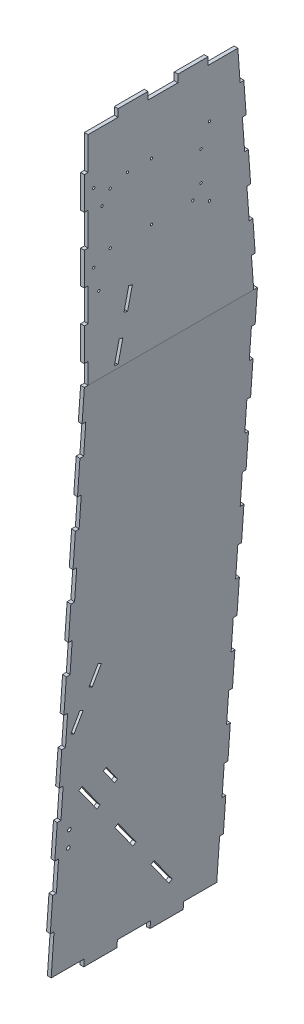
from build123d import *

# Parameters (mm, degrees)
BOSS_EXTRUDE1_DEPTH      = 469.9
SKETCH2_W                = 10.16
SKETCH2_H                = 83.651125112
SKETCH2_H_2              = 83.677721465
SKETCH2_H_3              = 83.704317819
SKETCH2_H_4              = 83.730914172
SKETCH2_H_5              = 83.757510526
SKETCH2_H_6              = 83.784106879
SKETCH2_H_7              = 83.810703233
SKETCH2_H_8              = 133.264269193
CUT_EXTRUDE1_DEPTH       = 10.16
SKETCH3_W                = 10.16
SKETCH3_H                = 55.879999965
SKETCH3_H_2              = 88.9
SKETCH3_H_3              = 109.22
CUT_EXTRUDE2_DEPTH       = 12.7
SKETCH4_W                = 81.316938584
SKETCH4_H                = 20.32
SKETCH4_W_2              = 81.316938585
CUT_EXTRUDE3_DEPTH       = 12.7
SKETCH5_W                = 89.916
SKETCH5_H                = 20.32
CUT_EXTRUDE4_DEPTH       = 12.7
SKETCH13_R               = 3.175
CUT_EXTRUDE8_DEPTH       = 2128.667464702
CUT_EXTRUDE9_DEPTH       = 2128.667464702
SKETCH20_R               = 4.7625
CUT_EXTRUDE10_DEPTH      = 2107.728843747
SKETCH24_R               = 3.175
CUT_EXTRUDE12_DEPTH      = 12.7
CUT_EXTRUDE13_DEPTH      = 2128.667464702
CUT_EXTRUDE13_DEPTH_BACK = 2128.667464702


with BuildPart() as part:
    # Sketch1 → Boss-Extrude1 (new body)
    with BuildSketch(Plane.XY):
        Polygon((-215.881789204, 2052.32), (-215.881789204, 1463.040000035), (-316.088635901, 20.32), (-317.499999939, 0), (-307.333509538, 0), (-205.715298803, 1463.040000035), (-205.715298803, 2072.64), (-215.881789204, 2072.64), align=None)
    extrude(amount=-BOSS_EXTRUDE1_DEPTH)

    # Sketch2 → Cut-Extrude1 (cut)
    with BuildSketch(Plane(origin=(-315.975651309, 21.946686571, 0), x_dir=(0, 0, 1), z_dir=(-0.9975965627192115, 0.06928995634877068, 0))):
        with Locations((-464.82, 1313.852971026)):
            Rectangle(SKETCH2_W, SKETCH2_H)
        with Locations((-464.82, 1136.066269203)):
            Rectangle(SKETCH2_W, SKETCH2_H_2)
        with Locations((-464.82, 958.27956738)):
            Rectangle(SKETCH2_W, SKETCH2_H_3)
        with Locations((-464.82, 780.492865556)):
            Rectangle(SKETCH2_W, SKETCH2_H_4)
        with Locations((-464.82, 602.706163733)):
            Rectangle(SKETCH2_W, SKETCH2_H_5)
        with Locations((-464.82, 424.91946191)):
            Rectangle(SKETCH2_W, SKETCH2_H_6)
        with Locations((-464.82, 247.132760087)):
            Rectangle(SKETCH2_W, SKETCH2_H_7)
        with Locations((-464.82, 44.63257346)):
            Rectangle(SKETCH2_W, SKETCH2_H_8)
        with Locations((-5.08, 44.63257346)):
            Rectangle(SKETCH2_W, SKETCH2_H_8)
        with Locations((-5.08, 247.132760087)):
            Rectangle(SKETCH2_W, SKETCH2_H_7)
        with Locations((-5.08, 424.91946191)):
            Rectangle(SKETCH2_W, SKETCH2_H_6)
        with Locations((-5.08, 602.706163733)):
            Rectangle(SKETCH2_W, SKETCH2_H_5)
        with Locations((-5.08, 780.492865556)):
            Rectangle(SKETCH2_W, SKETCH2_H_4)
        with Locations((-5.08, 958.27956738)):
            Rectangle(SKETCH2_W, SKETCH2_H_3)
        with Locations((-5.08, 1136.066269203)):
            Rectangle(SKETCH2_W, SKETCH2_H_2)
        with Locations((-5.08, 1313.852971026)):
            Rectangle(SKETCH2_W, SKETCH2_H)
    extrude(amount=-CUT_EXTRUDE1_DEPTH, mode=Mode.SUBTRACT)

    # Sketch3 → Cut-Extrude2 (cut)
    with BuildSketch(Plane.ZY.offset(215.881789204)):
        with Locations((-5.08, 1490.980000018)):
            Rectangle(SKETCH3_W, SKETCH3_H)
        with Locations((-5.08, 1652.27)):
            Rectangle(SKETCH3_W, SKETCH3_H_2)
        Polygon((-469.9, 1463.040000035), (-459.713026258, 1463.040000035), (-453.620872406, 1546.589538567), (-463.753970086, 1547.328410273), (-457.607940173, 1631.616820512), (-447.474842492, 1630.877948806), (-441.328812579, 1715.166359045), (-451.461910259, 1715.905230751), (-445.315880346, 1800.19364099), (-435.182782665, 1799.454769284), (-429.036752752, 1883.743179522), (-439.169850432, 1884.482051228), (-433.023820518, 1968.770461467), (-422.890722838, 1968.031589761), (-415.263026258, 2072.64), (-469.9, 2072.64), align=None)
        with Locations((-5.08, 1830.07)):
            Rectangle(SKETCH3_W, SKETCH3_H_2)
        with Locations((-5.08, 2018.03)):
            Rectangle(SKETCH3_W, SKETCH3_H_3)
    extrude(amount=-CUT_EXTRUDE2_DEPTH, mode=Mode.SUBTRACT)

    # Sketch4 → Cut-Extrude3 (cut)
    with BuildSketch(Plane.ZY.offset(215.881789204)):
        with Locations((-376.086223632, 2062.48)):
            Rectangle(SKETCH4_W, SKETCH4_H)
        with Locations((-213.452346463, 2062.48)):
            Rectangle(SKETCH4_W_2, SKETCH4_H)
        with Locations((-50.818469292, 2062.48)):
            Rectangle(SKETCH4_W_2, SKETCH4_H)
    extrude(amount=-CUT_EXTRUDE3_DEPTH, mode=Mode.SUBTRACT)

    # Sketch5 → Cut-Extrude4 (cut)
    with BuildSketch(Plane(origin=(-315.975651309, 21.946686571, 0), x_dir=(0, 0, 1), z_dir=(-0.9975965627192115, 0.06928995634877068, 0))):
        with Locations((-414.782, -11.839561137)):
            Rectangle(SKETCH5_W, SKETCH5_H)
        with Locations((-234.95, -11.839561137)):
            Rectangle(SKETCH5_W, SKETCH5_H)
        with Locations((-55.118, -11.839561137)):
            Rectangle(SKETCH5_W, SKETCH5_H)
    extrude(amount=-CUT_EXTRUDE4_DEPTH, mode=Mode.SUBTRACT)

    # Sketch13 → Cut-Extrude8 (cut, through all)
    with BuildSketch(Plane.ZY.offset(215.881789204)):
        with Locations((-25.246459893, 1731.87)):
            Circle(SKETCH13_R)
        with Locations((-70.408959893, 1755.42)):
            Circle(SKETCH13_R)
        with Locations((-182.408959893, 1755.42)):
            Circle(SKETCH13_R)
        with Locations((-25.246459893, 1918.97)):
            Circle(SKETCH13_R)
        with Locations((-47.788959893, 1865.42)):
            Circle(SKETCH13_R)
        with Locations((-182.408959893, 1910.42)):
            Circle(SKETCH13_R)
        with Locations((-117.078959893, 1910.42)):
            Circle(SKETCH13_R)
        with Locations((-70.408959893, 1895.42)):
            Circle(SKETCH13_R)
        with Locations((-317.028959893, 1865.42)):
            Circle(SKETCH13_R)
        with Locations((-294.408959893, 1755.42)):
            Circle(SKETCH13_R)
        with Locations((-317.028959893, 1785.42)):
            Circle(SKETCH13_R)
        with Locations((-339.571459893, 1731.87)):
            Circle(SKETCH13_R)
        with Locations((-339.571459893, 1918.97)):
            Circle(SKETCH13_R)
    extrude(amount=-CUT_EXTRUDE8_DEPTH, mode=Mode.SUBTRACT)

    # Sketch17 → Cut-Extrude9 (cut, through all)
    with BuildSketch(Plane.ZY.offset(215.881789204)):
        Polygon((-120.524654614, 1641.945974367), (-130.424254473, 1639.660471655), (-117.483615058, 1583.608404231), (-107.584015199, 1585.893906943), align=None)
        Polygon((-94.643375784, 1529.841839519), (-104.542975642, 1527.556336807), (-91.602336227, 1471.504269383), (-81.702736369, 1473.789772095), align=None)
    extrude(amount=-CUT_EXTRUDE9_DEPTH, mode=Mode.SUBTRACT)

    # Sketch20 → Cut-Extrude10 (cut, through all)
    with BuildSketch(Plane(origin=(-315.975651309, 21.946686571, 0), x_dir=(0, 0, 1), z_dir=(-0.9975965627192116, 0.06928995634876853, 0))):
        Polygon((-128.598334701, 451.361418049), (-162.492565561, 405.347250509), (-154.823537638, 399.698212032), (-120.929306778, 445.712379572), align=None)
        with Locations((-35.56, 347.287639338)):
            Circle(SKETCH20_R)
        with Locations((-35.56, 302.837639338)):
            Circle(SKETCH20_R)
    extrude(amount=-CUT_EXTRUDE10_DEPTH, mode=Mode.SUBTRACT)

    # Sketch24 → Cut-Extrude12 (cut)
    with BuildSketch(Plane.ZY.offset(215.881789204)):
        with Locations((-39.313746491, 1670.454214013)):
            Circle(SKETCH24_R)
    extrude(amount=-CUT_EXTRUDE12_DEPTH, mode=Mode.SUBTRACT)

    # Sketch26 → Cut-Extrude13 (cut, two sides: drawn at the far end of the back side and taken through both)
    with BuildSketch(Plane.ZY.offset(215.881789204).offset(-CUT_EXTRUDE13_DEPTH_BACK)):
        Polygon((-96.478494721, 741.073656933), (-74.89887104, 694.944067742), (-65.68812669, 699.232207156), (-87.26775037, 745.361796346), align=None)
        Polygon((-31.73962368, 602.684889361), (-22.52887933, 606.973028774), (-44.10850301, 653.102617965), (-53.31924736, 648.814478552), align=None)
        Polygon((-63.755697238, 458.569669358), (-117.688081031, 385.528057798), (-109.500847052, 379.511801077), (-55.568463259, 452.553412636), align=None)
        Polygon((-333.417616206, 93.36161156), (-325.230382227, 87.345354838), (-271.297998434, 160.386966398), (-279.485232413, 166.403223119), align=None)
        Polygon((-225.552848619, 239.444834679), (-217.372552167, 233.433675887), (-163.440168374, 306.475287447), (-171.620464825, 312.486446238), align=None)
    extrude(amount=CUT_EXTRUDE13_DEPTH + CUT_EXTRUDE13_DEPTH_BACK, mode=Mode.SUBTRACT)


solid = part.part
